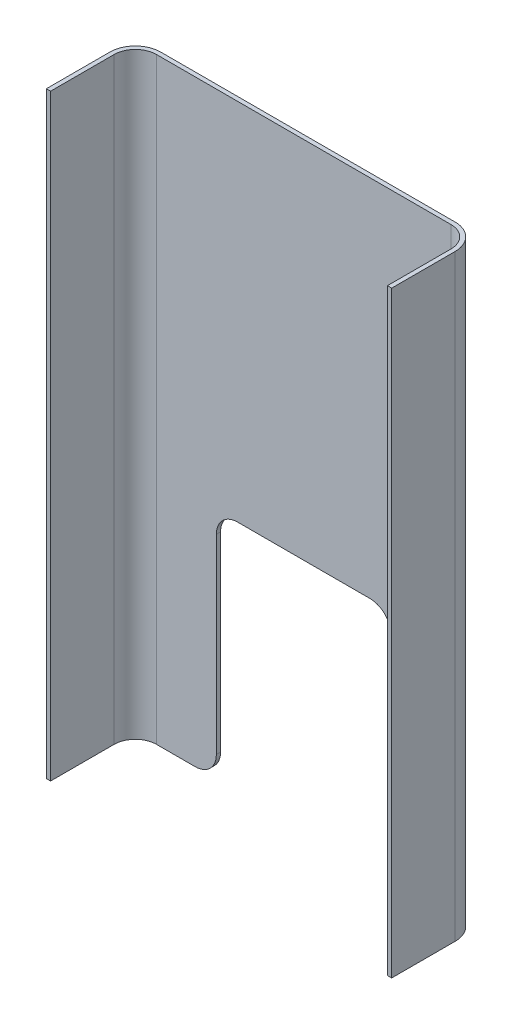
from build123d import *

# Parameters (mm, degrees)
EXTRUDE_THIN1_DEPTH     = 564
CUT_EXTRUDE2_DEPTH      = 594.060705156
CUT_EXTRUDE2_DEPTH_BACK = 594.060705156
SKETCH3_W               = 165
SKETCH3_H               = 220
FILLET1_R               = 20


with BuildPart() as part:
    # Sketch1 → Extrude-Thin1 (new body)
    with BuildSketch(Plane(origin=(0, 0, 0), x_dir=(1, 0, 0), z_dir=(0, 1, 0))):
        with BuildLine():
            Line((-159, -80), (-159, -20))
            ThreePointArc((-159, -20), (-153.142135624, -5.857864376), (-139, 0))
            Line((-139, 0), (139, 0))
            ThreePointArc((139, 0), (153.142135624, -5.857864376), (159, -20))
            Line((159, -20), (159, -80))
            Line((159, -80), (163, -80))
            Line((163, -80), (163, -20))
            ThreePointArc((163, -20), (155.970562748, -3.029437252), (139, 4))
            Line((139, 4), (-139, 4))
            ThreePointArc((-139, 4), (-155.970562748, -3.029437252), (-163, -20))
            Line((-163, -20), (-163, -80))
            Line((-163, -80), (-159, -80))
        make_face()
    extrude(amount=EXTRUDE_THIN1_DEPTH)

    # Sketch3 → Cut-Extrude2 (cut, two sides: drawn at the far end of the back side and taken through both)
    with BuildSketch(Plane(origin=(0, 0, -4), x_dir=(-1, 0, 0), z_dir=(0, 0, -1)).offset(-CUT_EXTRUDE2_DEPTH_BACK)):
        with Locations((0, 110)):
            Rectangle(SKETCH3_W, SKETCH3_H)
    extrude(amount=CUT_EXTRUDE2_DEPTH + CUT_EXTRUDE2_DEPTH_BACK, mode=Mode.SUBTRACT)

    # Fillet1
    fillet1_edges = [part.edges().sort_by_distance(p)[0] for p in [
        (-82.5, 0, -2),
        (82.5, 0, -2),
        (82.5, 220, -2),
        (-82.5, 220, -2),
    ]]
    fillet(fillet1_edges, radius=FILLET1_R)


solid = part.part
